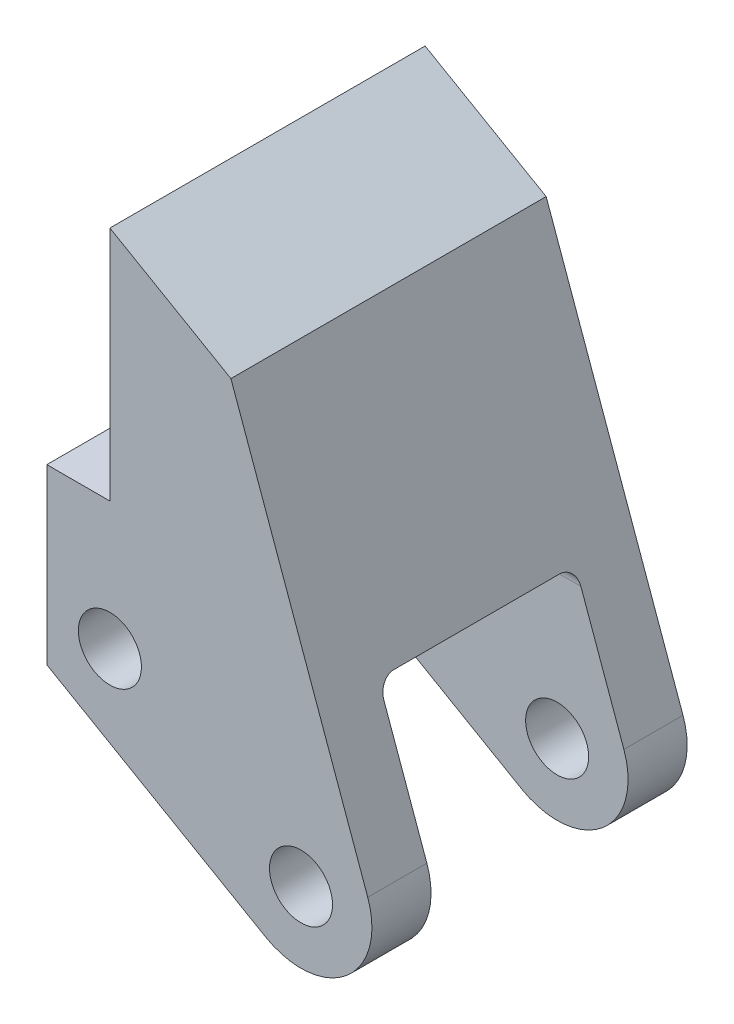
from build123d import *

# Parameters (mm, degrees)
SKETCH_1_R          = 4
EXTRUDE_1_DEPTH     = 40
SKETCH_2_W          = 25
SKETCH_2_H          = 31.038795999
CUT_EXTRUDE_1_DEPTH = 74.745137045
FILLET_3_R          = 2


with BuildPart() as part:
    # 草图1 → 凸台-拉伸1 (new body)
    with BuildSketch(Plane.XY):
        with BuildLine():
            Line((0, 46.226497308), (0, 16.226497308))
            Line((0, 16.226497308), (-8, 16.226497308))
            Line((-8, 16.226497308), (-8, -5.773502692))
            Line((-8, -5.773502692), (19.748711306, -21.794228634))
            ThreePointArc((19.748711306, -21.794228634), (30.019659504, -20.906240432), (32.718489579, -10.956505956))
            Line((32.718489579, -10.956505956), (15.356489888, 37.360423737))
            Line((15.356489888, 37.360423737), (0, 46.226497308))
        make_face()
        Circle(SKETCH_1_R, mode=Mode.SUBTRACT)
        with Locations((24.248711306, -14)):
            Circle(SKETCH_1_R, mode=Mode.SUBTRACT)
    extrude(amount=EXTRUDE_1_DEPTH)

    # 草图2 → 切除-拉伸1 (cut, through all)
    with BuildSketch(Plane.ZY.offset(8)):
        with Locations((20, -9.292900692)):
            Rectangle(SKETCH_2_W, SKETCH_2_H)
    extrude(amount=-CUT_EXTRUDE_1_DEPTH, mode=Mode.SUBTRACT)

    # 圆角3
    fillet_3_edges = [part.edges().sort_by_distance(p)[0] for p in [
        (9.272011192, 6.226497308, 7.5),
        (9.272011192, 6.226497308, 32.5),
    ]]
    fillet(fillet_3_edges, radius=FILLET_3_R)


solid = part.part
